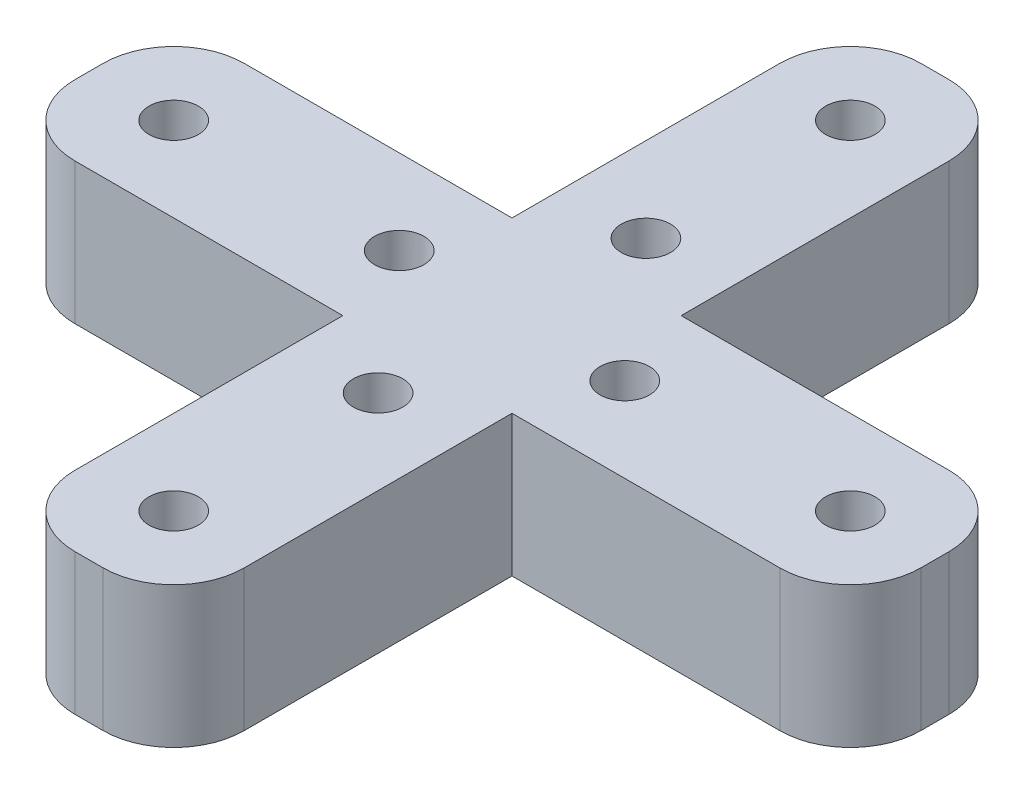
from build123d import *

# Parameters (mm, degrees)
BOSS_EXTRUDE1_DEPTH = 10
FILLET1_R           = 5
SKETCH2_R           = 1.75
CUT_EXTRUDE1_DEPTH  = 15
SKETCH3_R           = 1.75
CUT_EXTRUDE2_DEPTH  = 15
SKETCH4_R           = 3.25
CUT_EXTRUDE3_DEPTH  = 3


with BuildPart() as part:
    # Sketch1 → Boss-Extrude1 (new body)
    with BuildSketch(Plane(origin=(0, 0, 0), x_dir=(1, 0, 0), z_dir=(0, 1, 0))):
        Polygon((6, 6), (30, 6), (30, -6), (6, -6), (6, -30), (-6, -30), (-6, -6), (-30, -6), (-30, 6), (-6, 6), (-6, 30), (6, 30), align=None)
    extrude(amount=BOSS_EXTRUDE1_DEPTH)

    # Fillet1
    fillet1_edges = [part.edges().sort_by_distance(p)[0] for p in [
        (30, 5, -6),
        (30, 5, 6),
        (6, 5, 30),
        (-6, 5, 30),
        (-30, 5, 6),
        (-30, 5, -6),
        (-6, 5, -30),
        (6, 5, -30),
    ]]
    fillet(fillet1_edges, radius=FILLET1_R)

    # Sketch2 → Cut-Extrude1 (cut)
    with BuildSketch(Plane(origin=(0, 10, 0), x_dir=(1, 0, 0), z_dir=(0, 1, 0))):
        with Locations(Location((-8, 0, 0), (0, 0, 270))):
            Circle(SKETCH2_R)
        with Locations(Location((8, 0, 0), (0, 0, 270))):
            Circle(SKETCH2_R)
        with Locations(Location((0, 9.5, 0), (0, 0, 270))):
            Circle(SKETCH2_R)
        with Locations(Location((0, -9.5, 0), (0, 0, 270))):
            Circle(SKETCH2_R)
    extrude(amount=-CUT_EXTRUDE1_DEPTH, mode=Mode.SUBTRACT)

    # Sketch3 → Cut-Extrude2 (cut)
    with BuildSketch(Plane(origin=(0, 10, 0), x_dir=(1, 0, 0), z_dir=(0, 1, 0))):
        with Locations(Location((0, 24, 0), (0, 0, 270))):
            Circle(SKETCH3_R)
        with Locations(Location((24, 0, 0), (0, 0, 270))):
            Circle(SKETCH3_R)
        with Locations(Location((-24, 0, 0), (0, 0, 270))):
            Circle(SKETCH3_R)
        with Locations(Location((0, -24, 0), (0, 0, 270))):
            Circle(SKETCH3_R)
    extrude(amount=-CUT_EXTRUDE2_DEPTH, mode=Mode.SUBTRACT)

    # Sketch4 → Cut-Extrude3 (cut)
    with BuildSketch(Plane.XZ):
        with Locations(Location((0, -9.5, 0), (0, 0, 270))):
            Circle(SKETCH4_R)
        with Locations(Location((-8, 0, 0), (0, 0, 270))):
            Circle(SKETCH4_R)
        with Locations(Location((8, 0, 0), (0, 0, 270))):
            Circle(SKETCH4_R)
        with Locations(Location((0, 9.5, 0), (0, 0, 270))):
            Circle(SKETCH4_R)
    extrude(amount=-CUT_EXTRUDE3_DEPTH, mode=Mode.SUBTRACT)


solid = part.part
